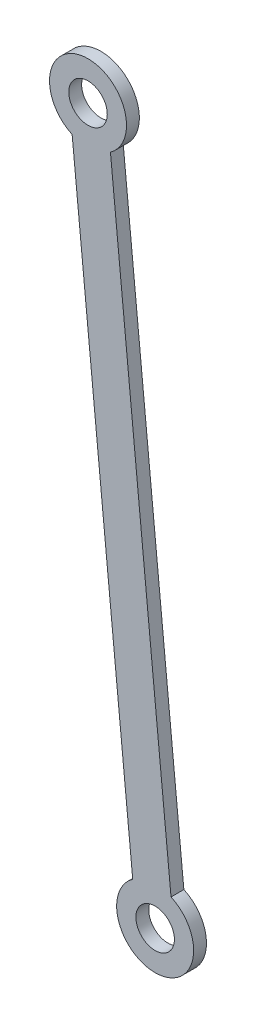
from build123d import *

# Parameters (mm, degrees)
BOSS_EXTRUDE1_DEPTH = 3


with BuildPart() as part:
    # Sketch1 → Boss-Extrude1 (new body)
    with BuildSketch(Plane.XY):
        with BuildLine():
            ThreePointArc((27.040784053, 219.089006289), (13.163562513, 226.652914674), (14.326848487, 210.891038089))
            Line((14.326848487, 210.891038089), (13.562475801, 218.647695514))
            ThreePointArc((13.562475801, 218.647695514), (17.599473278, 223.567314541), (22.519092305, 219.530317065))
            Line((22.519092305, 219.530317065), (23.28346499, 211.773659641))
            ThreePointArc((23.28346499, 211.773659641), (26.046535999, 214.977080246), (27.040784053, 219.089006289))
        make_face()
        with BuildLine():
            Line((13.562475801, 218.647695514), (14.326848487, 210.891038089))
            ThreePointArc((14.326848487, 210.891038089), (18.923405604, 210.132389785), (23.28346499, 211.773659641))
            Line((23.28346499, 211.773659641), (22.519092305, 219.530317065))
            ThreePointArc((22.519092305, 219.530317065), (18.482094829, 214.610698037), (13.562475801, 218.647695514))
        make_face()
        with BuildLine():
            Line((14.326848487, 210.891038089), (28.489152913, 67.175615091))
            ThreePointArc((28.489152913, 67.175615091), (32.849212299, 68.816884946), (37.445769417, 68.058236642))
            Line((37.445769417, 68.058236642), (23.28346499, 211.773659641))
            ThreePointArc((23.28346499, 211.773659641), (18.923405604, 210.132389785), (14.326848487, 210.891038089))
        make_face()
        with BuildLine():
            ThreePointArc((38.210142102, 60.301579218), (34.173144626, 55.381960191), (29.253525599, 59.418957667))
            Line((29.253525599, 59.418957667), (28.489152913, 67.175615091))
            ThreePointArc((28.489152913, 67.175615091), (29.619907807, 51.854516497), (42.73183385, 59.860268443))
            ThreePointArc((42.73183385, 59.860268443), (41.295742235, 64.737489982), (37.445769417, 68.058236642))
            Line((37.445769417, 68.058236642), (38.210142102, 60.301579218))
        make_face()
        with BuildLine():
            Line((28.489152913, 67.175615091), (29.253525599, 59.418957667))
            ThreePointArc((29.253525599, 59.418957667), (33.290523075, 64.338576695), (38.210142102, 60.301579218))
            Line((38.210142102, 60.301579218), (37.445769417, 68.058236642))
            ThreePointArc((37.445769417, 68.058236642), (32.849212299, 68.816884946), (28.489152913, 67.175615091))
        make_face()
    extrude(amount=-BOSS_EXTRUDE1_DEPTH)


solid = part.part
